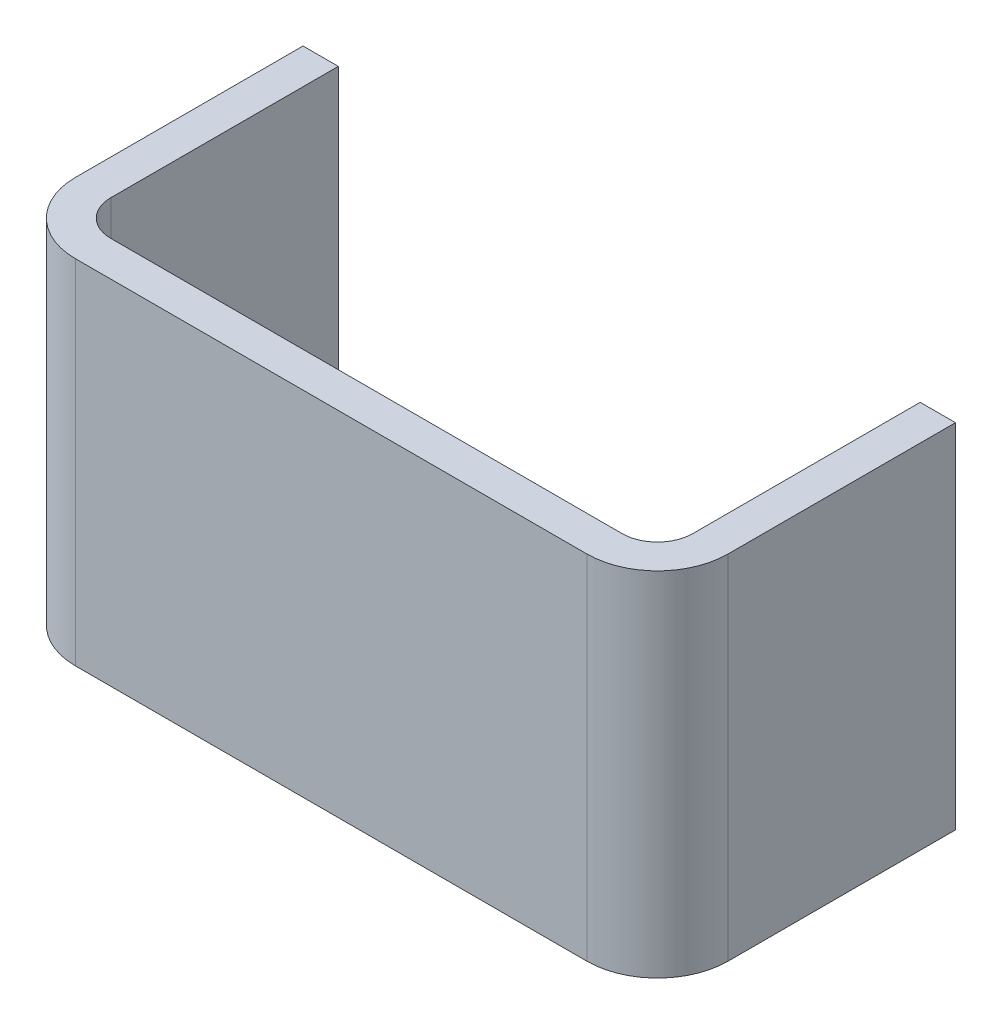
from build123d import *

# Parameters (mm, degrees)
BOSS_EXTRUDE2_DEPTH = 20


with BuildPart() as part:
    # Sketch1 → Boss-Extrude2 (new body)
    with BuildSketch(Plane(origin=(0, 0, 0), x_dir=(1, 0, 0), z_dir=(0, 1, 0))):
        with BuildLine():
            Line((1.36644496, -14.394460771), (-13.63355504, -14.394460771))
            ThreePointArc((-13.63355504, -14.394460771), (-15.047768603, -13.808674334), (-15.63355504, -12.394460771))
            Line((-15.63355504, -12.394460771), (-15.63355504, 0.505539229))
            Line((-15.63355504, 0.505539229), (-17.63355504, 0.505539229))
            Line((-17.63355504, 0.505539229), (-17.63355504, -12.394460771))
            ThreePointArc((-17.63355504, -12.394460771), (-16.461982165, -15.222887896), (-13.63355504, -16.394460771))
            Line((-13.63355504, -16.394460771), (1.36644496, -16.394460771))
            Line((1.36644496, -16.394460771), (15.36644496, -16.394460771))
            ThreePointArc((15.36644496, -16.394460771), (18.194872084, -15.222887896), (19.36644496, -12.394460771))
            Line((19.36644496, -12.394460771), (19.36644496, 0.505539229))
            Line((19.36644496, 0.505539229), (17.36644496, 0.505539229))
            Line((17.36644496, 0.505539229), (17.36644496, -12.394460771))
            ThreePointArc((17.36644496, -12.394460771), (16.780658522, -13.808674334), (15.36644496, -14.394460771))
            Line((15.36644496, -14.394460771), (1.36644496, -14.394460771))
        make_face()
    extrude(amount=BOSS_EXTRUDE2_DEPTH)


solid = part.part
